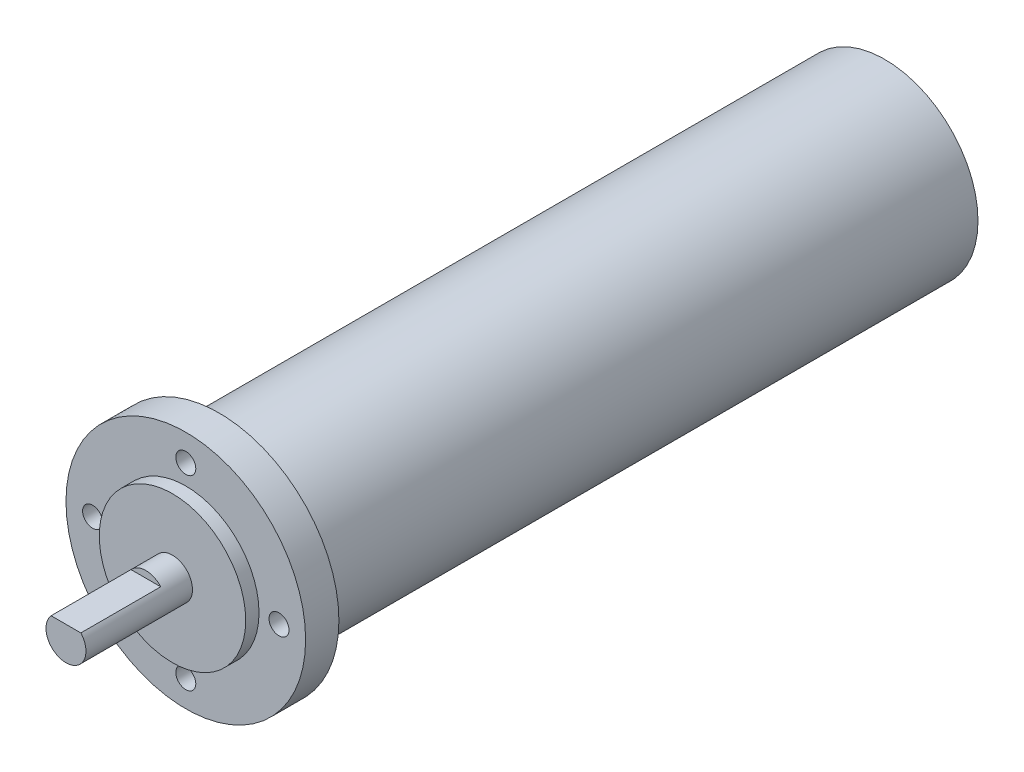
from build123d import *

# Parameters (mm, degrees)
SKETCH1_R           = 14
BOSS_EXTRUDE3_DEPTH = 100
SKETCH4_R           = 18
BOSS_EXTRUDE4_DEPTH = 5
SKETCH5_R           = 1.5
CUT_EXTRUDE2_DEPTH  = 4
SKETCH6_R           = 11
BOSS_EXTRUDE6_DEPTH = 2
SKETCH7_R           = 3
BOSS_EXTRUDE7_DEPTH = 16
SKETCH8_W           = 13.782002666
SKETCH8_H           = 7.151039119
CUT_EXTRUDE3_DEPTH  = 8


with BuildPart() as part:
    # Sketch1 → Boss-Extrude3 (new body)
    with BuildSketch(Plane.XY):
        Circle(SKETCH1_R)
    extrude(amount=BOSS_EXTRUDE3_DEPTH)

    # Sketch4 → Boss-Extrude4 (add)
    with BuildSketch(Plane.XY.offset(100)):
        Circle(SKETCH4_R)
    extrude(amount=BOSS_EXTRUDE4_DEPTH)

    # Sketch5 → Cut-Extrude2 (cut)
    with BuildSketch(Plane.XY.offset(105)):
        with Locations((0, 14)):
            Circle(SKETCH5_R)
        with Locations((14, 0)):
            Circle(SKETCH5_R)
        with Locations((0, -14)):
            Circle(SKETCH5_R)
        with Locations((-14, 0)):
            Circle(SKETCH5_R)
    extrude(amount=-CUT_EXTRUDE2_DEPTH, mode=Mode.SUBTRACT)

    # Sketch6 → Boss-Extrude6 (add)
    with BuildSketch(Plane.XY.offset(105)):
        Circle(SKETCH6_R)
    extrude(amount=BOSS_EXTRUDE6_DEPTH)

    # Sketch7 → Boss-Extrude7 (add)
    with BuildSketch(Plane.XY.offset(107)):
        Circle(SKETCH7_R)
    extrude(amount=BOSS_EXTRUDE7_DEPTH)

    # Sketch8 → Cut-Extrude3 (cut, symmetric)
    with BuildSketch(Plane(origin=(0, 0, 0), x_dir=(0, 0, -1), z_dir=(1, 0, 0))):
        with Locations((-117.891001333, 5.575519559)):
            Rectangle(SKETCH8_W, SKETCH8_H)
    extrude(amount=CUT_EXTRUDE3_DEPTH, both=True, mode=Mode.SUBTRACT)


solid = part.part
